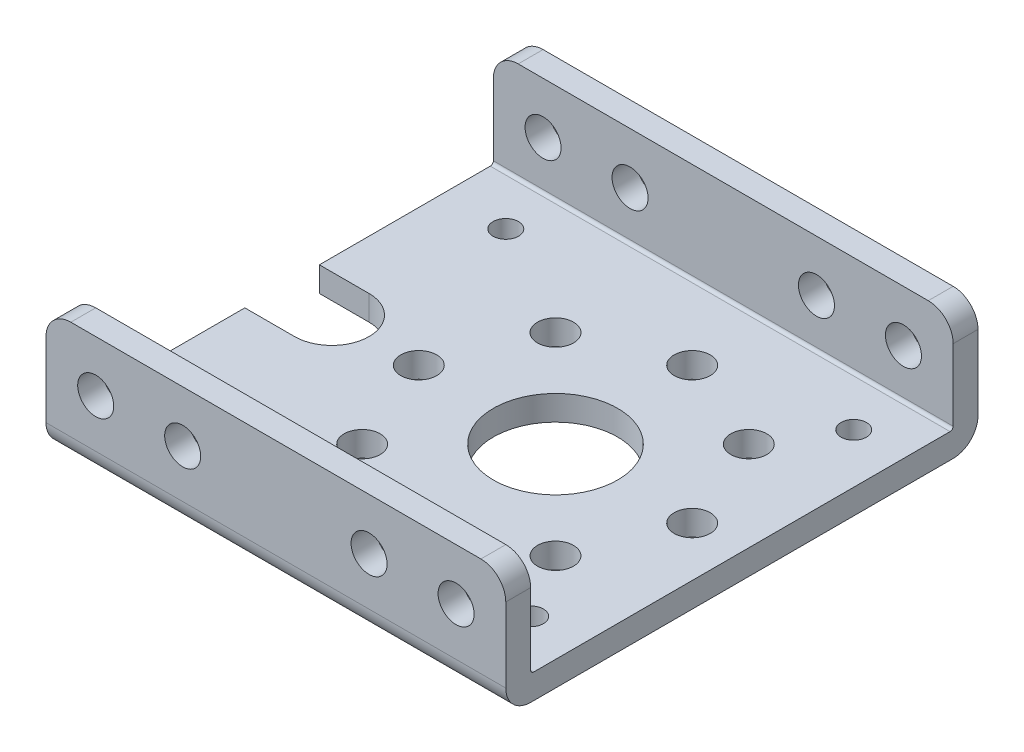
from build123d import *

# Parameters (mm, degrees)
BOSS_EXTRUDE1_DEPTH       = 2
SKETCH2_W                 = 37
SKETCH2_H                 = 2
SKETCH2_H_2               = 2.001734714
BOSS_EXTRUDE2_DEPTH       = 8
FILLET1_R                 = 2
FILLET2_R                 = 0.25
TAP_DRILL_FOR_M2_5_TAP1_D = 2.05
SKETCH5_R                 = 5
CUT_EXTRUDE1_DEPTH        = 28.699277969
M2_5_CLEARANCE_HOLE1_D    = 2.9
CIRPATTERN1_COUNT         = 8
M2_5_CLEARANCE_HOLE2_D    = 2.9


with BuildPart() as part:
    # Sketch1 → Boss-Extrude1 (new body)
    with BuildSketch(Plane(origin=(0, 0, 0), x_dir=(1, 0, 0), z_dir=(0, 1, 0))):
        with BuildLine():
            Line((-14.5, 3), (-18.5, 3))
            Line((-18.5, 3), (-18.5, 19))
            Line((-18.5, 19), (18.5, 19))
            Line((18.5, 19), (18.5, -19))
            Line((18.5, -19), (-18.5, -19))
            Line((-18.5, -19), (-18.5, -3))
            Line((-18.5, -3), (-14.5, -3))
            ThreePointArc((-14.5, -3), (-11.5, 0), (-14.5, 3))
        make_face()
    extrude(amount=BOSS_EXTRUDE1_DEPTH)

    # Sketch2 → Boss-Extrude2 (add)
    with BuildSketch(Plane(origin=(0, 2, 0), x_dir=(1, 0, 0), z_dir=(0, 1, 0))):
        with Locations((0, 18)):
            Rectangle(SKETCH2_W, SKETCH2_H)
        with Locations((0, -17.999132643)):
            Rectangle(SKETCH2_W, SKETCH2_H_2)
    extrude(amount=BOSS_EXTRUDE2_DEPTH)

    # Fillet1
    fillet1_edges = [part.edges().sort_by_distance(p)[0] for p in [
        (0, 0, -19),
        (-18.5, 10, -18),
        (18.5, 10, -18),
        (-18.5, 10, 17.999132643),
        (18.5, 10, 17.999132643),
        (0, 0, 19),
    ]]
    fillet(fillet1_edges, radius=FILLET1_R)

    # Fillet2
    fillet2_edges = [part.edges().sort_by_distance(p)[0] for p in [
        (0, 2, -17),
        (0, 2, 16.998265286),
    ]]
    fillet(fillet2_edges, radius=FILLET2_R)

    # Tap Drill for M2.5 Tap1 (through all)
    with Locations(Plane(origin=(0, 2, 0), x_dir=(1, 0, 0), z_dir=(0, 1, 0))):
        with Locations((-13.5, 13), (14.5, 13), (14.5, -13), (-13.5, -13)):
            Hole(TAP_DRILL_FOR_M2_5_TAP1_D / 2)

    # Sketch5 → Cut-Extrude1 (cut, through all)
    with BuildSketch(Plane(origin=(0, 2, 0), x_dir=(1, 0, 0), z_dir=(0, 1, 0))):
        with Locations(Location((3.5, 0, 0), (0, 0, 270))):
            Circle(SKETCH5_R)
    extrude(amount=-CUT_EXTRUDE1_DEPTH, mode=Mode.SUBTRACT)

    # M2.5 Clearance Hole1 (through all)
    with Locations(Plane(origin=(0, 2, 0), x_dir=(1, 0, 0), z_dir=(0, 1, 0))):
        with Locations((3.5, 11)):
            m2_5_clearance_hole1 = Hole(M2_5_CLEARANCE_HOLE1_D / 2)

    # CirPattern1: M2.5 Clearance Hole1 ×8 about axis
    cirpattern1_axis = Axis((3.5, 0, 0), (0, 1, 0))
    for i in range(1, CIRPATTERN1_COUNT):
        add(m2_5_clearance_hole1.rotate(cirpattern1_axis, i * 360 / CIRPATTERN1_COUNT), mode=Mode.SUBTRACT)

    # M2.5 Clearance Hole2 (through all)
    with Locations(Plane.XY.offset(19)):
        with Locations((-14.5, 5.870134778), (-7.5, 5.870134778), (7.5, 5.870134778), (14.5, 5.870134778)):
            Hole(M2_5_CLEARANCE_HOLE2_D / 2)


solid = part.part
